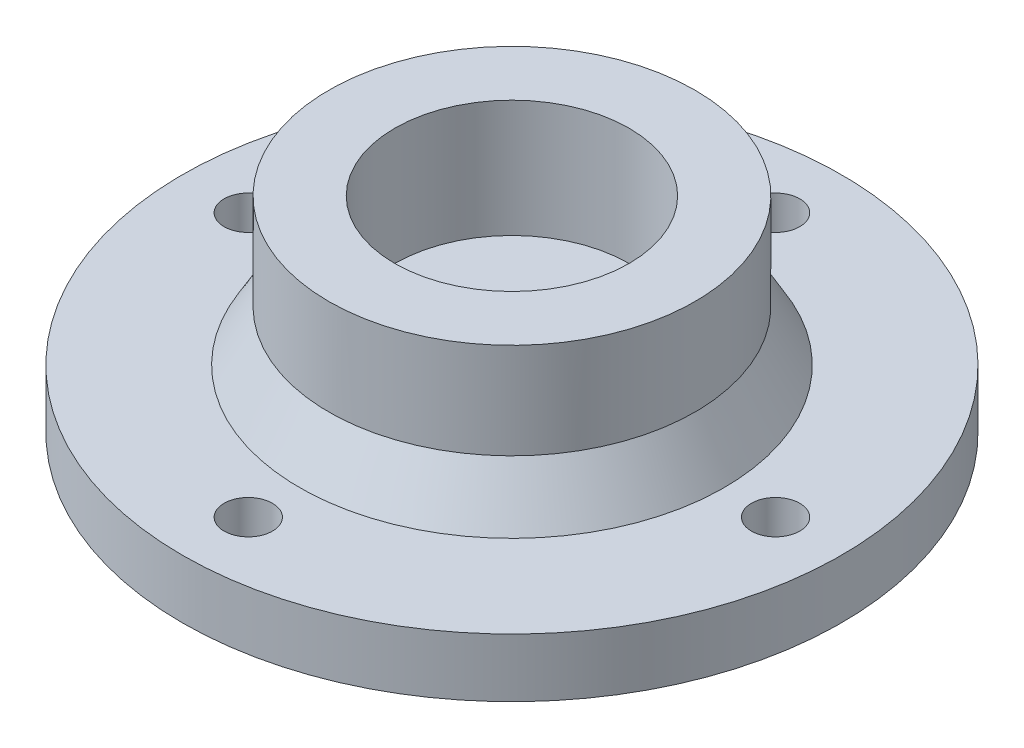
from build123d import *

# Parameters (mm, degrees)
SKETCH_1_R          = 22.5
SKETCH_1_R_2        = 1.65
EXTRUDE_1_DEPTH     = 4
SKETCH_2_R          = 12.5
SKETCH_2_R_2        = 8
EXTRUDE_2_DEPTH     = 10
SKETCH_3_R          = 4
CUT_EXTRUDE_1_DEPTH = 3
SKETCH_4_R          = 8
EXTRUDE_3_DEPTH     = 2
SKETCH_3_3_R        = 1.6
CUT_EXTRUDE_2_DEPTH = 10
CHAMFER_1_SIZE      = 2
CHAMFER_1_SIZE2     = 3.464101615


with BuildPart() as part:
    # 草图1 → 凸台-拉伸1 (new body)
    with BuildSketch(Plane(origin=(0, 0, 0), x_dir=(1, 0, 0), z_dir=(0, 1, 0))):
        Circle(SKETCH_1_R)
        with Locations((-18, 0)):
            Circle(SKETCH_1_R_2, mode=Mode.SUBTRACT)
        with Locations((18, 0)):
            Circle(SKETCH_1_R_2, mode=Mode.SUBTRACT)
        with Locations((0, 18)):
            Circle(SKETCH_1_R_2, mode=Mode.SUBTRACT)
        with Locations((0, -18)):
            Circle(SKETCH_1_R_2, mode=Mode.SUBTRACT)
    extrude(amount=EXTRUDE_1_DEPTH)

    # 草图2 → 凸台-拉伸2 (add)
    with BuildSketch(Plane(origin=(0, 4, 0), x_dir=(1, 0, 0), z_dir=(0, 1, 0))):
        Circle(SKETCH_2_R)
        Circle(SKETCH_2_R_2, mode=Mode.SUBTRACT)
    extrude(amount=EXTRUDE_2_DEPTH)

    # 草图3 → 切除-拉伸1 (cut)
    with BuildSketch(Plane.XZ):
        Circle(SKETCH_3_R)
    extrude(amount=-CUT_EXTRUDE_1_DEPTH, mode=Mode.SUBTRACT)

    # 草图4 → 凸台-拉伸3 (add)
    with BuildSketch(Plane(origin=(0, 4, 0), x_dir=(1, 0, 0), z_dir=(0, 1, 0))):
        Circle(SKETCH_4_R)
    extrude(amount=EXTRUDE_3_DEPTH)

    # 草图3<3> → 切除-拉伸2 (cut)
    with BuildSketch(Plane.XZ):
        Circle(SKETCH_3_3_R)
    extrude(amount=-CUT_EXTRUDE_2_DEPTH, mode=Mode.SUBTRACT)

    # 倒角1
    chamfer_1_edges = [part.edges().sort_by_distance(p)[0] for p in [
        (-12.5, 4, 0),
    ]]
    chamfer_1_side = [part.faces().sort_by_distance(p)[0] for p in [
        (-21.863603897, 4, 0),
    ]]
    chamfer(chamfer_1_edges, length=CHAMFER_1_SIZE, length2=CHAMFER_1_SIZE2, reference=chamfer_1_side[0])


solid = part.part
